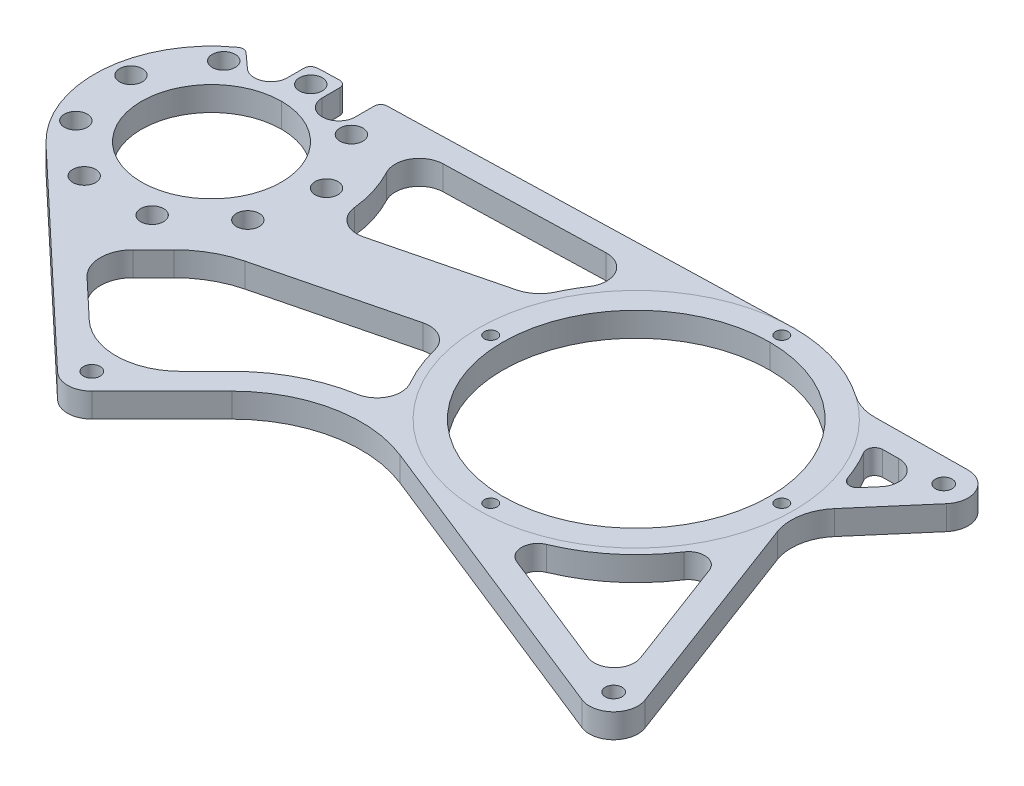
from build123d import *

# Parameters (mm, degrees)
MASTER_SKETCH_R       = 52.451
MASTER_SKETCH_R_2     = 9.525
MASTER_SKETCH_R_3     = 45.974
MASTER_SKETCH_R_4     = 27.4955
MASTER_SKETCH_R_5     = 6.5
BOSS_EXTRUDE2_DEPTH   = 4.7625
F_5_0MM_DOWEL_HOLE1_D = 5
CIRPATTERN4_COUNT     = 4
M6_CLEARANCE_HOLE4_D  = 6.6
M8_CLEARANCE_HOLE1_D  = 9
CIRPATTERN3_COUNT     = 9
CUT_EXTRUDE2_DEPTH    = 284.948803699
CUT_EXTRUDE3_DEPTH    = 284.948803699
FILLET1_R             = 2.54


with BuildPart() as part:
    # Master Sketch → Boss-Extrude2 (new, symmetric)
    # profile 1 of 5: a face of its own
    with BuildSketch(Plane(origin=(0, 0, 0), x_dir=(1, 0, 0), z_dir=(0, 1, 0))):
        with BuildLine():
            ThreePointArc((-8.636, 127), (-36.396097826, 84.787887478), (-86.152093601, 93.552952189))
            Line((-86.152093601, 93.552952189), (-6.534964144, 18.470363023))
            ThreePointArc((-6.534964144, 18.470363023), (-3.773598517, 34.145603423), (9.525, 25.4))
            ThreePointArc((9.525, 25.4), (8.799952547, 21.754940307), (6.735192091, 18.664807909))
            Line((6.735192091, 18.664807909), (34.255961574, 46.185577392))
            ThreePointArc((34.255961574, 46.185577392), (59.945142207, 60.02346539), (89.010077776, 57.44457682))
            Line((89.010077776, 57.44457682), (207.987004211, 9.951947906))
            ThreePointArc((207.987004211, 9.951947906), (204.851852042, 25.601533276), (220.43444462, 22.148779315))
            Line((220.43444462, 22.148779315), (189.133864847, 105.44289655))
            ThreePointArc((189.133864847, 105.44289655), (188.207777178, 115.4635324), (192.51641215, 124.557840832))
            Line((192.51641215, 124.557840832), (212.800120602, 148.168522003))
            ThreePointArc((212.800120602, 148.168522003), (196.940842995, 150.353698677), (205.472725722, 163.899866417))
            Line((205.472725722, 163.899866417), (169.599038165, 163.514054819))
            ThreePointArc((169.599038165, 163.514054819), (163.800537316, 164.352688386), (158.531122559, 166.913779261))
            ThreePointArc((158.531122559, 166.913779261), (141.706259737, 175.147152322), (123.19, 177.9778))
            Line((123.19, 177.9778), (-54.61, 172.974))
            ThreePointArc((-54.61, 172.974), (-22.101472842, 159.508527158), (-8.636, 127))
        make_face()
        with Locations(Location((123.19, 116.0018, 0), (0, 0, 90))):
            Circle(MASTER_SKETCH_R, mode=Mode.SUBTRACT)
    # profile 2 of 5: a face of its own
    with BuildSketch(Plane(origin=(0, 0, 0), x_dir=(1, 0, 0), z_dir=(0, 1, 0))):
        with Locations((0, 25.4)):
            Circle(MASTER_SKETCH_R_2)
    # profile 3 of 5: a face of its own
    with BuildSketch(Plane(origin=(0, 0, 0), x_dir=(1, 0, 0), z_dir=(0, 1, 0))):
        with Locations((211.518208908, 18.79820239)):
            Circle(MASTER_SKETCH_R_2)
    # profile 4 of 5: a face of its own
    with BuildSketch(Plane(origin=(0, 0, 0), x_dir=(1, 0, 0), z_dir=(0, 1, 0))):
        with Locations((205.575158542, 154.375417219)):
            Circle(MASTER_SKETCH_R_2)
    # profile 5 of 5: a face of its own
    with BuildSketch(Plane(origin=(0, 0, 0), x_dir=(1, 0, 0), z_dir=(0, 1, 0))):
        with Locations((-54.61, 127)):
            Circle(MASTER_SKETCH_R_3)
        with Locations(Location((-54.61, 127, 0), (0, 0, 90))):
            Circle(MASTER_SKETCH_R_4, mode=Mode.SUBTRACT)
        with Locations(Location((-67.94878559, 163.648012211, 0), (0, 0, 90))):
            Circle(MASTER_SKETCH_R_5, mode=Mode.SUBTRACT)
        with Locations(Location((-41.27121441, 163.648012211, 0), (0, 0, 90))):
            Circle(MASTER_SKETCH_R_5, mode=Mode.SUBTRACT)
    extrude(amount=BOSS_EXTRUDE2_DEPTH, both=True)

    # Ø5.0mm Dowel Hole1 (through all)
    with Locations(Plane(origin=(0, 4.7625, 0), x_dir=(1, 0, 0), z_dir=(0, 1, 0))):
        with Locations((123.19, 173.1518)):
            f_5_0mm_dowel_hole1 = Hole(F_5_0MM_DOWEL_HOLE1_D / 2)

    # CirPattern4: Ø5.0mm Dowel Hole1 ×4 about axis
    cirpattern4_axis = Axis((123.19, 0, -116.0018), (0, 1, 0))
    for i in range(1, CIRPATTERN4_COUNT):
        add(f_5_0mm_dowel_hole1.rotate(cirpattern4_axis, i * 360 / CIRPATTERN4_COUNT), mode=Mode.SUBTRACT)

    # M6 Clearance Hole4 (through all)
    with Locations(Plane(origin=(0, 4.7625, 0), x_dir=(1, 0, 0), z_dir=(0, 1, 0))):
        with Locations((205.575158542, 154.375417219), (211.518208908, 18.79820239), (0, 25.4)):
            Hole(M6_CLEARANCE_HOLE4_D / 2)

    # M8 Clearance Hole1 (through all)
    with Locations(Plane(origin=(0, 4.7625, 0), x_dir=(1, 0, 0), z_dir=(0, 1, 0))):
        with Locations((-54.61, 166)):
            m8_clearance_hole1 = Hole(M8_CLEARANCE_HOLE1_D / 2)

    # CirPattern3: M8 Clearance Hole1 ×9 about axis
    cirpattern3_axis = Axis((-54.61, 0, -127), (0, 1, 0))
    for i in range(1, CIRPATTERN3_COUNT):
        add(m8_clearance_hole1.rotate(cirpattern3_axis, i * 360 / CIRPATTERN3_COUNT), mode=Mode.SUBTRACT)

    # Topology 3 → Cut-Extrude2 (cut, through all)
    with BuildSketch(Plane(origin=(0, 4.7625, 0), x_dir=(1, 0, 0), z_dir=(0, 1, 0))):
        with BuildLine():
            ThreePointArc((148.153589294, 55.823132596), (164.735029841, 65.81551406), (177.648151764, 80.239214699))
            ThreePointArc((177.648151764, 80.239214699), (183.658143307, 83.064639882), (188.900120968, 78.987300553))
            Line((188.900120968, 78.987300553), (205.194131764, 35.627233252))
            ThreePointArc((205.194131764, 35.627233252), (203.319232726, 27.16564341), (194.821264757, 25.463207079))
            Line((194.821264757, 25.463207079), (148.232551201, 44.060262413))
            ThreePointArc((148.232551201, 44.060262413), (144.236830733, 49.915140022), (148.153589294, 55.823132596))
        make_face()
        with BuildLine():
            Line((190.127076346, 136.393510988), (194.150985671, 141.077429629))
            ThreePointArc((194.150985671, 141.077429629), (195.32544691, 149.601274428), (188.044823271, 154.186883307))
            Line((188.044823271, 154.186883307), (181.870154841, 154.120476454))
            ThreePointArc((181.870154841, 154.120476454), (179.135815493, 152.500048502), (179.17593949, 149.321874737))
            ThreePointArc((179.17593949, 149.321874737), (182.248718341, 143.510354832), (184.720207534, 137.418764347))
            ThreePointArc((184.720207534, 137.418764347), (187.127250613, 135.343061567), (190.127076346, 136.393510988))
        make_face()
        with BuildLine():
            ThreePointArc((64.098067009, 143.438932802), (66.306808777, 147.765857633), (68.831828447, 151.916170194))
            ThreePointArc((68.831828447, 151.916170194), (69.209050275, 161.796201373), (60.61677272, 166.688039353))
            Line((60.61677272, 166.688039353), (-1.663792567, 164.935286301))
            ThreePointArc((-1.663792567, 164.935286301), (-9.632748017, 160.197249287), (-9.798074059, 150.927626155))
            ThreePointArc((-9.798074059, 150.927626155), (-6.09260405, 142.056636088), (-4.12477238, 132.646396384))
            ThreePointArc((-4.12477238, 132.646396384), (-0.093621954, 125.882803807), (7.651359628, 124.464488392))
            Line((7.651359628, 124.464488392), (55.659374127, 136.466492017))
            ThreePointArc((55.659374127, 136.466492017), (60.668494681, 138.996854714), (64.098067009, 143.438932802))
        make_face()
        with BuildLine():
            ThreePointArc((17.44176984, 42.84176984), (-0.146601343, 35.405008389), (-17.945313453, 42.323250142))
            Line((-17.945313453, 42.323250142), (-33.032755262, 56.551396808))
            ThreePointArc((-33.032755262, 56.551396808), (-37.018106584, 65.604842248), (-33.299725858, 74.771168898))
            Line((-33.299725858, 74.771168898), (-25.157987823, 82.912906934))
            ThreePointArc((-25.157987823, 82.912906934), (-16.98904431, 89.126755018), (-7.457826773, 92.934567826))
            Line((-7.457826773, 92.934567826), (48.48636159, 106.920614917))
            ThreePointArc((48.48636159, 106.920614917), (55.6852269, 105.854731176), (60.030376503, 100.016970919))
            ThreePointArc((60.030376503, 100.016970919), (62.745475764, 91.688999032), (66.553177874, 83.800508404))
            ThreePointArc((66.553177874, 83.800508404), (66.885503662, 75.024623751), (59.896219631, 69.707058463))
            ThreePointArc((59.896219631, 69.707058463), (42.409632623, 63.819008448), (27.520769483, 52.920769483))
            Line((27.520769483, 52.920769483), (17.44176984, 42.84176984))
        make_face()
    extrude(amount=-CUT_EXTRUDE2_DEPTH, mode=Mode.SUBTRACT)

    # Sketch29 → Cut-Extrude3 (cut, through all)
    with BuildSketch(Plane.XZ.offset(4.7625)):
        with BuildLine():
            Line((-72.305646266, -158.824345033), (-79.713448931, -165.515263569))
            ThreePointArc((-79.713448931, -165.515263569), (-70.954498766, -169.970525201), (-61.44878559, -172.462508594))
            Line((-61.44878559, -172.462508594), (-61.44878559, -163.648012211))
            ThreePointArc((-61.44878559, -163.648012211), (-70.587952655, -169.588112984), (-72.305646266, -158.824345033))
        make_face()
        with BuildLine():
            Line((-47.77121441, -163.648012211), (-47.77121441, -173.166462966))
            Line((-47.77121441, -173.166462966), (-34.77121441, -173.532320109))
            Line((-34.77121441, -173.532320109), (-34.77121441, -163.648012211))
            ThreePointArc((-34.77121441, -163.648012211), (-41.27121441, -170.148012211), (-47.77121441, -163.648012211))
        make_face()
    extrude(amount=-CUT_EXTRUDE3_DEPTH, mode=Mode.SUBTRACT)

    # Fillet1
    fillet1_edges = [part.edges().sort_by_distance(p)[0] for p in [
        (-79.713448931, 0, -165.515263569),
        (-61.44878559, 0, -172.462508594),
        (-47.77121441, 0, -173.166462966),
        (-34.77121441, 0, -173.532320109),
    ]]
    fillet(fillet1_edges, radius=FILLET1_R)


solid = part.part
